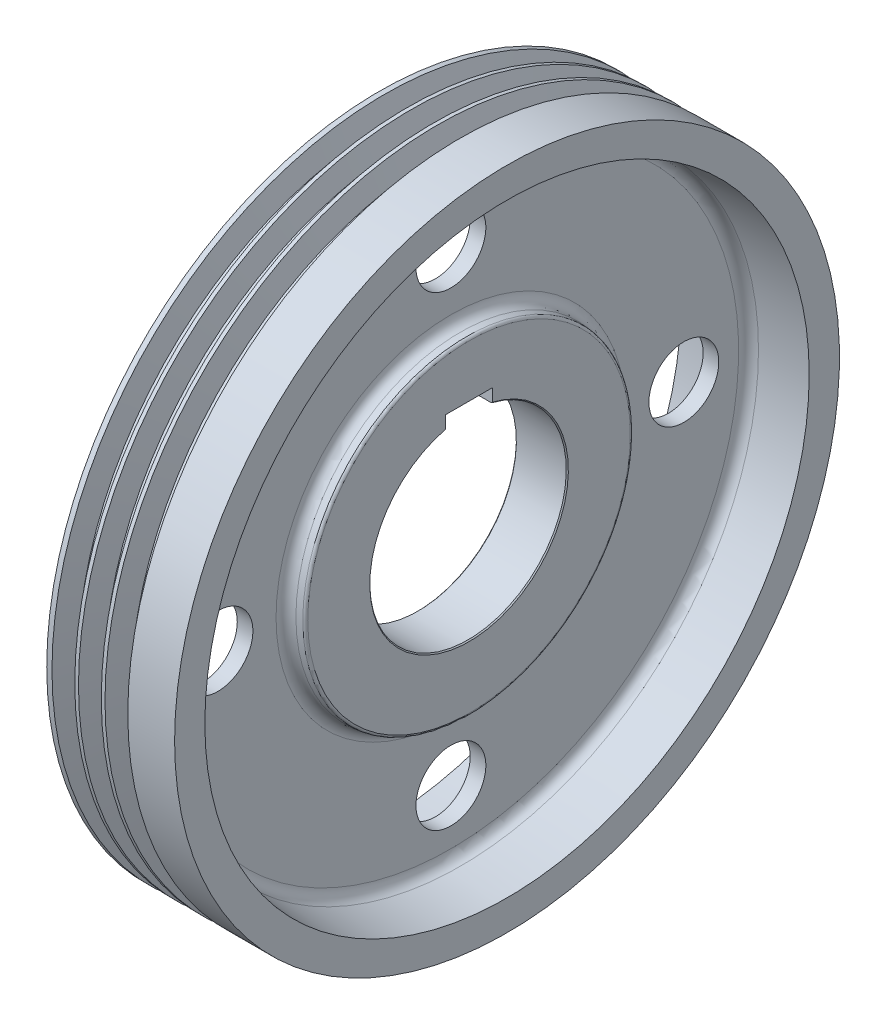
from build123d import *

# Parameters (mm, degrees)
PATTERN_LINEAR_943_COUNT    = 3
PATTERN_LINEAR_943_PITCH    = 25.5
CHAMFER_1_SIZE              = 1
SKETCH_4_W                  = 45
SKETCH_4_H                  = 13.117648374
CUT_EXTRUDE_1_DEPTH         = 461.463168994
FILLET_1_R                  = 10
FILLET_2_R                  = 2.5
SKETCH_5_R                  = 33.6
CUT_EXTRUDE_2_DEPTH         = 469.692948528
PATTERN_CIRCULAR_1811_COUNT = 4


with BuildPart() as part:
    # 草图1 → 旋转1 (revolve)
    with BuildSketch(Plane.XY, mode=Mode.PRIVATE) as revolve_1_sk:
        Polygon((36.5, 94.5), (36.5, 157.5), (54, 159.031051612), (54, 285.97561217), (0, 290.7), (0, 319.8), (123, 319.8), (123, 290.7), (69, 285.97561217), (69, 159.031051612), (86.5, 157.5), (86.5, 94.5), align=None)
    revolve(revolve_1_sk.sketch.rotate(Axis((0, 0, 0), (1, 0, 0)), 90), axis=Axis((0, 0, 0), (1, 0, 0)))

    # 草图2 → 切除-旋转1 (revolve, cut)
    with BuildSketch(Plane.XY, mode=Mode.PRIVATE) as cut_revolve_1_sk:
        Polygon((21.128051255, 300.7), (26.967507271, 319.8), (5.032492729, 319.8), (10.871948745, 300.7), align=None)
    cut_revolve_1 = revolve(cut_revolve_1_sk.sketch.rotate(Axis((0, 0, 0), (1, 0, 0)), 90), axis=Axis((0, 0, 0), (1, 0, 0)), mode=Mode.SUBTRACT)

    # Pattern Linear 943: 切除-旋转1 ×3
    with Locations(*[(i * PATTERN_LINEAR_943_PITCH, 0, 0) for i in range(1, PATTERN_LINEAR_943_COUNT)]):
        add(cut_revolve_1, mode=Mode.SUBTRACT)

    # 倒角1
    chamfer_1_edges = [part.edges().sort_by_distance(p)[0] for p in [
        (36.5, 0, -94.5),
        (86.5, 0, -94.5),
    ]]
    chamfer(chamfer_1_edges, length=CHAMFER_1_SIZE)

    # 草图4 → 切除-拉伸1 (cut, through all)
    with BuildSketch(Plane.ZY.offset(-36.5)):
        with Locations((0, 98.341175432)):
            Rectangle(SKETCH_4_W, SKETCH_4_H)
    extrude(amount=-CUT_EXTRUDE_1_DEPTH, mode=Mode.SUBTRACT)

    # 圆角1
    fillet_1_edges = [part.edges().sort_by_distance(p)[0] for p in [
        (54, 0, -285.97561217),
        (54, 0, -159.031051612),
        (69, 0, -159.031051612),
        (69, 0, -285.97561217),
    ]]
    fillet(fillet_1_edges, radius=FILLET_1_R)

    # 圆角2
    fillet_2_edges = [part.edges().sort_by_distance(p)[0] for p in [
        (36.5, 0, -157.5),
        (86.5, 0, -157.5),
    ]]
    fillet(fillet_2_edges, radius=FILLET_2_R)

    # 草图5 → 切除-拉伸2 (cut, through all)
    with BuildSketch(Plane(origin=(0, 0, 0), x_dir=(0, 0, -1), z_dir=(1, 0, 0))):
        with Locations(Location((0, 224.1, 0), (0, 0, 180))):
            Circle(SKETCH_5_R)
    cut_extrude_2 = extrude(amount=CUT_EXTRUDE_2_DEPTH, mode=Mode.SUBTRACT)

    # Pattern Circular 1811: 切除-拉伸2 ×4 about axis
    pattern_circular_1811_axis = Axis((0, 0, 0), (1, 0, 0))
    for i in range(1, PATTERN_CIRCULAR_1811_COUNT):
        add(cut_extrude_2.rotate(pattern_circular_1811_axis, i * 360 / PATTERN_CIRCULAR_1811_COUNT), mode=Mode.SUBTRACT)


solid = part.part
